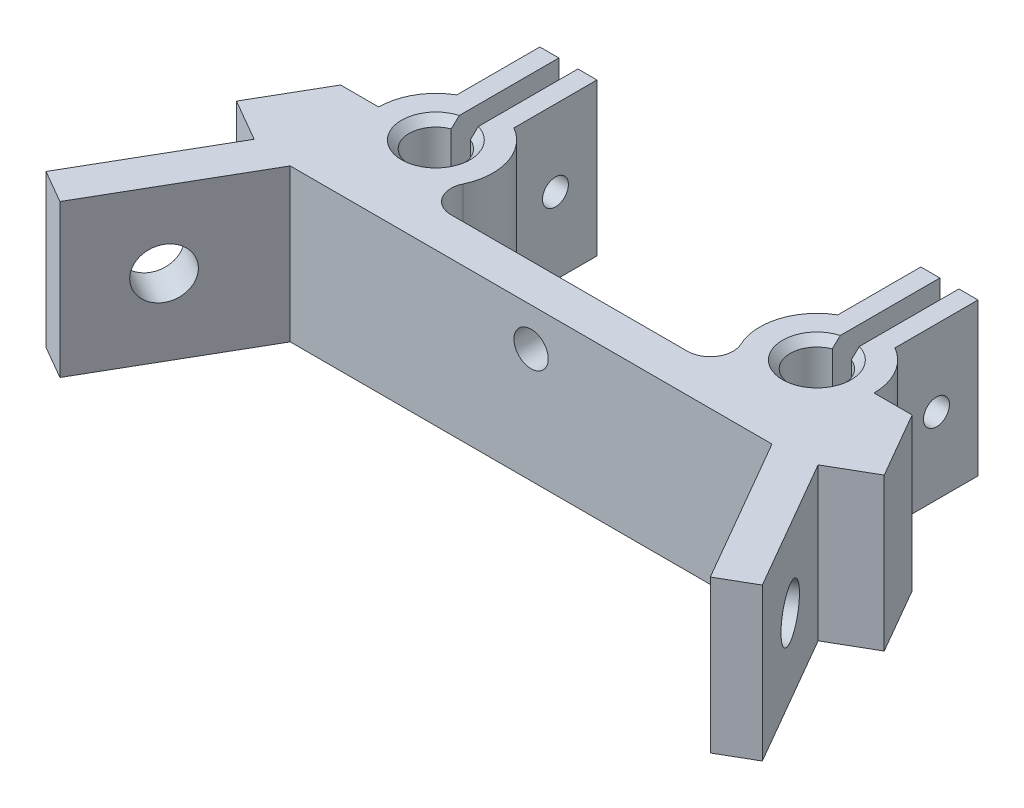
from build123d import *

# Parameters (mm, degrees)
BOSS_EXTRUDE1_DEPTH = 20
SKETCH2_R           = 1.7
CUT_EXTRUDE1_DEPTH  = 28.75
CUT_EXTRUDE2_REACH  = 61.184
SKETCH4_R           = 2.25
CHAMFER1_SIZE       = 1
CUT_EXTRUDE3_REACH  = 155.199
SKETCH5_R           = 3.3


with BuildPart() as part:
    # Sketch1 → Boss-Extrude1 (new body)
    with BuildSketch(Plane(origin=(0, 0, 0), x_dir=(1, 0, 0), z_dir=(0, 1, 0))):
        with BuildLine():
            ThreePointArc((26.25, 120.769174208), (25, 114), (23.75, 120.769174208))
            Line((23.75, 120.769174208), (23.75, 134.895099729))
            Line((23.75, 134.895099729), (21.25, 134.895099729))
            Line((21.25, 134.895099729), (21.25, 123.995190528))
            ThreePointArc((21.25, 123.995190528), (17.839743095, 119.73175291), (18.223690728, 114.285714286))
            ThreePointArc((18.223690728, 114.285714286), (18.048629784, 111.396432549), (15.513167019, 110))
            Line((15.513167019, 110), (-15.513167019, 110))
            ThreePointArc((-15.513167019, 110), (-18.048629784, 111.396432549), (-18.223690728, 114.285714286))
            ThreePointArc((-18.223690728, 114.285714286), (-17.839743095, 119.73175291), (-21.25, 123.995190528))
            Line((-21.25, 123.995190528), (-21.25, 134.895099729))
            Line((-21.25, 134.895099729), (-23.75, 134.895099729))
            Line((-23.75, 134.895099729), (-23.75, 120.769174208))
            ThreePointArc((-23.75, 120.769174208), (-25, 114), (-26.25, 120.769174208))
            Line((-26.25, 120.769174208), (-26.25, 134.895099729))
            Line((-26.25, 134.895099729), (-28.75, 134.895099729))
            Line((-28.75, 134.895099729), (-28.75, 123.995190528))
            ThreePointArc((-28.75, 123.995190528), (-31.495190528, 121.25), (-32.5, 117.5))
            Line((-32.5, 117.5), (-37.5, 117.5))
            Line((-37.5, 117.5), (-42.5, 108.839745962))
            Line((-42.5, 108.839745962), (-37.000738686, 105.664745962))
            Line((-37.000738686, 105.664745962), (-47.000738686, 88.344237886))
            Line((-47.000738686, 88.344237886), (-42.670611667, 85.844237886))
            Line((-42.670611667, 85.844237886), (-31.611027254, 105))
            Line((-31.611027254, 105), (31.611027254, 105))
            Line((31.611027254, 105), (42.670611667, 85.844237886))
            Line((42.670611667, 85.844237886), (47.000738686, 88.344237886))
            Line((47.000738686, 88.344237886), (37.000738686, 105.664745962))
            Line((37.000738686, 105.664745962), (42.5, 108.839745962))
            Line((42.5, 108.839745962), (37.5, 117.5))
            Line((37.5, 117.5), (32.5, 117.5))
            ThreePointArc((32.5, 117.5), (31.495190528, 121.25), (28.75, 123.995190528))
            Line((28.75, 123.995190528), (28.75, 134.895099729))
            Line((28.75, 134.895099729), (26.25, 134.895099729))
            Line((26.25, 134.895099729), (26.25, 120.769174208))
        make_face()
    extrude(amount=BOSS_EXTRUDE1_DEPTH)

    # Sketch2 → Cut-Extrude1 (cut, symmetric)
    with BuildSketch(Plane(origin=(0, 0, 0), x_dir=(0, 0, -1), z_dir=(1, 0, 0))):
        with Locations((129.445145129, 10)):
            Circle(SKETCH2_R)
    extrude(amount=CUT_EXTRUDE1_DEPTH, both=True, mode=Mode.SUBTRACT)

    # Sketch4 → Cut-Extrude2 (cut, up to next)
    with BuildSketch(Plane.XY.offset(-105), mode=Mode.PRIVATE) as cut_extrude2_sk1:
        with Locations((0, 15)):
            Circle(SKETCH4_R)
    cut_extrude2_tool1 = extrude(cut_extrude2_sk1.sketch, amount=-CUT_EXTRUDE2_REACH, mode=Mode.PRIVATE) & part.part
    add(cut_extrude2_tool1.solids().sort_by_distance((0, 15, -105))[0], mode=Mode.SUBTRACT)

    # Chamfer1
    chamfer1_edges = [part.edges().sort_by_distance(p)[0] for p in [
        (25, 20, -114),
        (-25, 20, -114),
    ]]
    chamfer(chamfer1_edges, length=CHAMFER1_SIZE)

    # Sketch5 → Cut-Extrude3 (cut, up to next)
    with BuildSketch(Plane(origin=(-73.504731158, 0, -42.437976321), x_dir=(-0.49999999999998673, 0, 0.8660254037844464), z_dir=(-0.8660254037844464, 0, -0.49999999999998673)), mode=Mode.PRIVATE) as cut_extrude3_sk1:
        with Locations((-63.007984945, 10)):
            Circle(SKETCH5_R)
    cut_extrude3_tool1 = extrude(cut_extrude3_sk1.sketch, amount=-CUT_EXTRUDE3_REACH, mode=Mode.PRIVATE) & part.part
    cut_extrude3 = cut_extrude3_tool1.solids().sort_by_distance((-42.000739, 10, -97.004492))[0]
    add(cut_extrude3, mode=Mode.SUBTRACT)

    # Mirror1: Cut-Extrude3 across plane
    add(cut_extrude3.mirror(Plane(origin=(0, 0, 0), x_dir=(0, 0, 1), z_dir=(1, 0, 0))), mode=Mode.SUBTRACT)


solid = part.part
